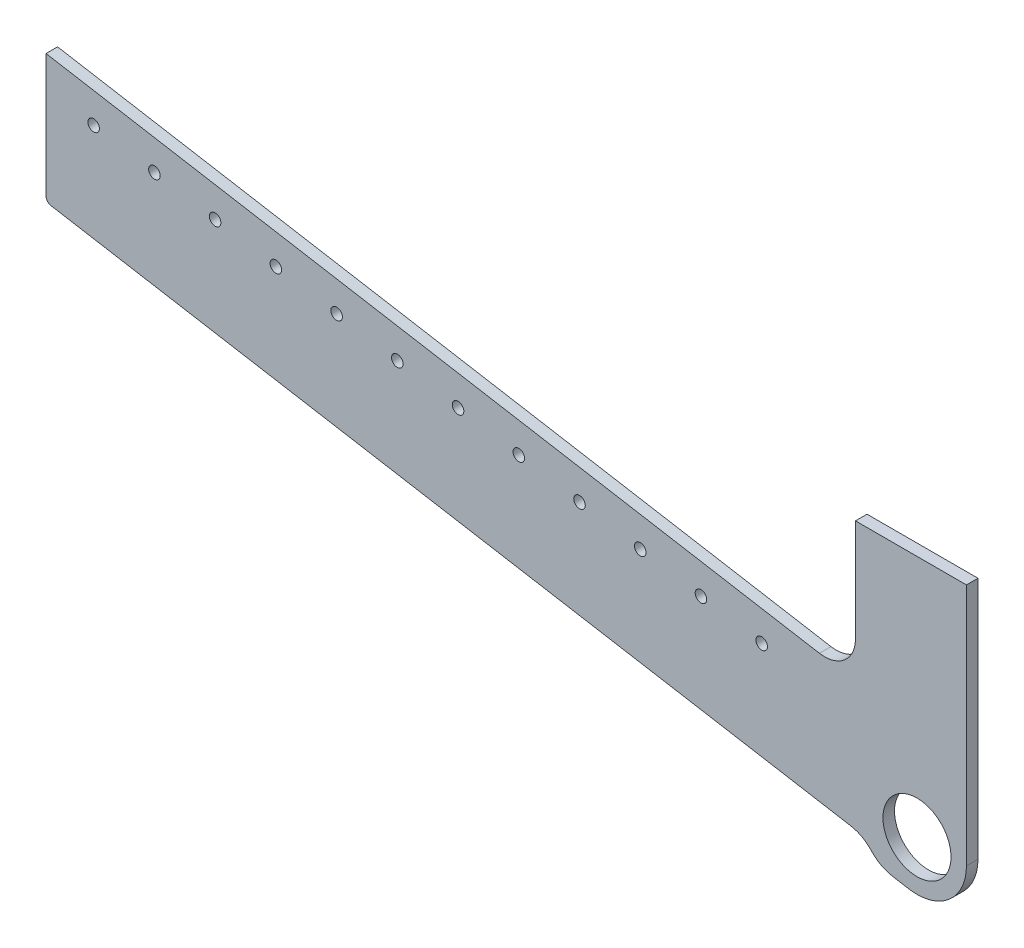
from build123d import *

# Parameters (mm, degrees)
SKETCH1_R           = 14.0335
SKETCH1_R_2         = 2.38125
BOSS_EXTRUDE1_DEPTH = 4.7625
CUT_EXTRUDE1_DEPTH  = 219.425881909


with BuildPart() as part:
    # Sketch1 → Boss-Extrude1 (new body)
    with BuildSketch(Plane.XY):
        with BuildLine():
            Line((165.542350471, -12.850928795), (158.864493489, -11.70515089))
            ThreePointArc((158.864493489, -11.70515089), (154.154566121, -10.06953751), (150.224583517, -7.001332225))
            ThreePointArc((150.224583517, -7.001332225), (146.294597206, -3.933124046), (141.584665397, -2.297509122))
            Line((141.584665397, -2.297509122), (-187.944818486, 54.242725653))
            ThreePointArc((-187.944818486, 54.242725653), (-189.457270687, 55.108983561), (-190.055285337, 56.746143572))
            Line((-190.055285337, 56.746143572), (-190.055285337, 107.546143572))
            Line((-190.055285337, 107.546143572), (128.771239178, 52.842308466))
            ThreePointArc((128.771239178, 52.842308466), (139.104704977, 55.649471309), (143.618904922, 65.359398058))
            Line((143.618904922, 65.359398058), (143.618904922, 107.546143572))
            Line((143.618904922, 107.546143572), (189.37285399, 107.546143572))
            Line((189.37285399, 107.546143572), (189.37285399, 7.239))
            ThreePointArc((189.37285399, 7.239), (182.127563077, -8.345432433), (165.542350471, -12.850928795))
        make_face()
        with Locations(Location((168.98935399, 7.239, 0), (0, 0, 180))):
            Circle(SKETCH1_R, mode=Mode.SUBTRACT)
        with Locations(Location((104.970773751, 44.478080628, 0), (0, 0, 180))):
            Circle(SKETCH1_R_2, mode=Mode.SUBTRACT)
        with Locations(Location((79.936594567, 48.773412116, 0), (0, 0, 180))):
            Circle(SKETCH1_R_2, mode=Mode.SUBTRACT)
        with Locations(Location((54.902415383, 53.068743605, 0), (0, 0, 180))):
            Circle(SKETCH1_R_2, mode=Mode.SUBTRACT)
        with Locations(Location((29.868236199, 57.364075093, 0), (0, 0, 180))):
            Circle(SKETCH1_R_2, mode=Mode.SUBTRACT)
        with Locations(Location((4.834057015, 61.659406581, 0), (0, 0, 180))):
            Circle(SKETCH1_R_2, mode=Mode.SUBTRACT)
        with Locations(Location((-20.200122168, 65.95473807, 0), (0, 0, 180))):
            Circle(SKETCH1_R_2, mode=Mode.SUBTRACT)
        with Locations(Location((-45.234301352, 70.250069558, 0), (0, 0, 180))):
            Circle(SKETCH1_R_2, mode=Mode.SUBTRACT)
        with Locations(Location((-70.268480536, 74.545401047, 0), (0, 0, 180))):
            Circle(SKETCH1_R_2, mode=Mode.SUBTRACT)
        with Locations(Location((-170.405197271, 91.726727, 0), (0, 0, 180))):
            Circle(SKETCH1_R_2, mode=Mode.SUBTRACT)
        with Locations(Location((-145.371018087, 87.431395512, 0), (0, 0, 180))):
            Circle(SKETCH1_R_2, mode=Mode.SUBTRACT)
        with Locations(Location((-120.336838903, 83.136064023, 0), (0, 0, 180))):
            Circle(SKETCH1_R_2, mode=Mode.SUBTRACT)
        with Locations(Location((-95.30265972, 78.840732535, 0), (0, 0, 180))):
            Circle(SKETCH1_R_2, mode=Mode.SUBTRACT)
    extrude(amount=BOSS_EXTRUDE1_DEPTH)

    # Sketch3 → Cut-Extrude1 (cut, through all)
    with BuildSketch(Plane.XY.offset(4.7625)):
        with BuildLine():
            Line((125.87285399, 333.30748602), (115.993328583, 323.427960612))
            ThreePointArc((115.993328583, 323.427960612), (112.023332702, 320.973988275), (107.375068785, 320.553881036))
            Line((107.375068785, 320.553881036), (17.92285399, 333.30748602))
            Line((17.92285399, 333.30748602), (125.87285399, 333.30748602))
        make_face()
    extrude(amount=-CUT_EXTRUDE1_DEPTH, mode=Mode.SUBTRACT)


solid = part.part
